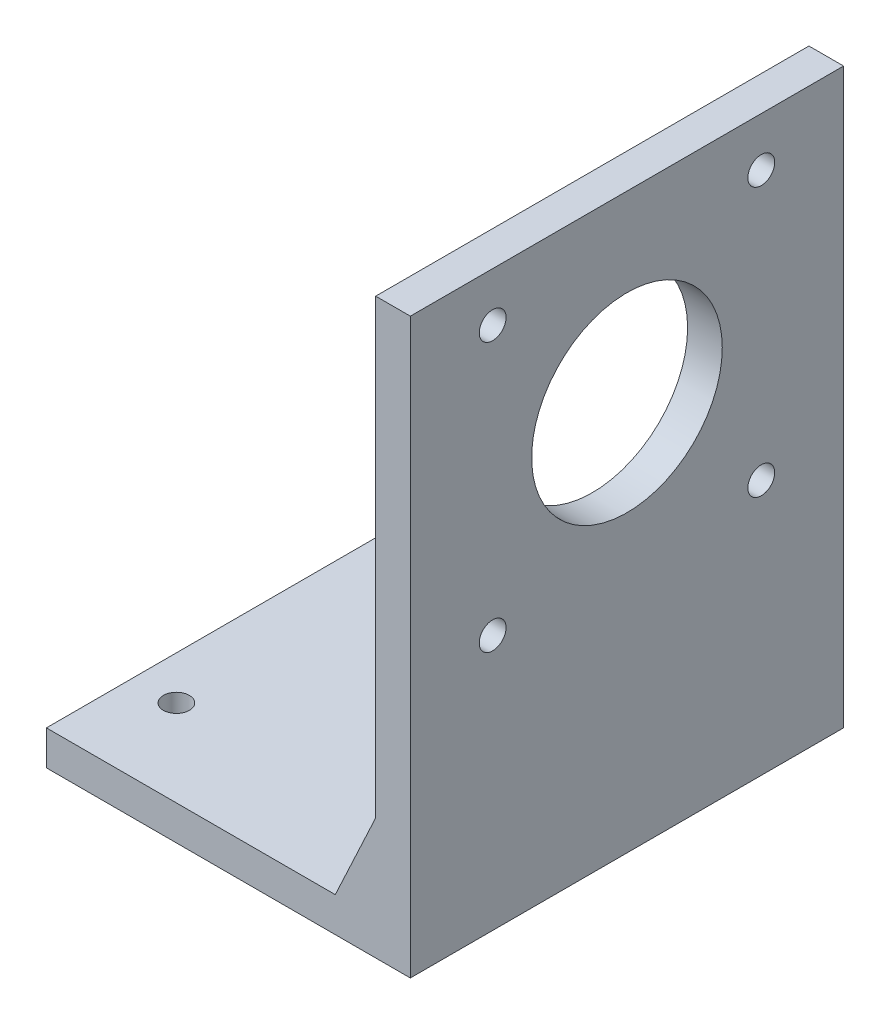
from build123d import *

# Parameters (mm, degrees)
SKETCH1_W           = 50
SKETCH1_H           = 66.15
SKETCH1_R           = 11
SKETCH1_R_2         = 1.55
BOSS_EXTRUDE1_DEPTH = 4
SKETCH2_W           = 50
SKETCH2_H           = 4
BOSS_EXTRUDE2_DEPTH = 38
SKETCH3_R           = 1.5
CUT_EXTRUDE1_DEPTH  = 78.017027338
CHAMFER1_SIZE       = 10
CHAMFER1_SIZE2      = 4.663076582


with BuildPart() as part:
    # Sketch1 → Boss-Extrude1 (new body)
    with BuildSketch(Plane(origin=(0, 0, 0), x_dir=(0, 0, -1), z_dir=(1, 0, 0))):
        Rectangle(SKETCH1_W, SKETCH1_H)
        with Locations((0, 11.925)):
            Circle(SKETCH1_R, mode=Mode.SUBTRACT)
        with Locations((-15.5, 27.425)):
            Circle(SKETCH1_R_2, mode=Mode.SUBTRACT)
        with Locations((15.5, 27.425)):
            Circle(SKETCH1_R_2, mode=Mode.SUBTRACT)
        with Locations((15.5, -3.575)):
            Circle(SKETCH1_R_2, mode=Mode.SUBTRACT)
        with Locations((-15.5, -3.575)):
            Circle(SKETCH1_R_2, mode=Mode.SUBTRACT)
    extrude(amount=BOSS_EXTRUDE1_DEPTH)

    # Sketch2 → Boss-Extrude2 (add)
    with BuildSketch(Plane.ZY):
        with Locations((0, -31.075)):
            Rectangle(SKETCH2_W, SKETCH2_H)
    extrude(amount=BOSS_EXTRUDE2_DEPTH)

    # Sketch3 → Cut-Extrude1 (cut, through all)
    with BuildSketch(Plane(origin=(0, -29.075, 0), x_dir=(1, 0, 0), z_dir=(0, 1, 0))):
        with Locations(Location((-33, -15, 0), (0, 0, 270))):
            Circle(SKETCH3_R)
        with Locations(Location((-8, -15, 0), (0, 0, 270))):
            Circle(SKETCH3_R)
        with Locations(Location((-8, 15, 0), (0, 0, 90))):
            Circle(SKETCH3_R)
        with Locations(Location((-33, 15, 0), (0, 0, 90))):
            Circle(SKETCH3_R)
    extrude(amount=-CUT_EXTRUDE1_DEPTH, mode=Mode.SUBTRACT)

    # Chamfer1
    chamfer1_edges = [part.edges().sort_by_distance(p)[0] for p in [
        (0, -29.075, 0),
    ]]
    chamfer1_side = [part.faces().sort_by_distance(p)[0] for p in [
        (0, 0.490102601, 0),
    ]]
    chamfer(chamfer1_edges, length=CHAMFER1_SIZE, length2=CHAMFER1_SIZE2, reference=chamfer1_side[0])


solid = part.part
